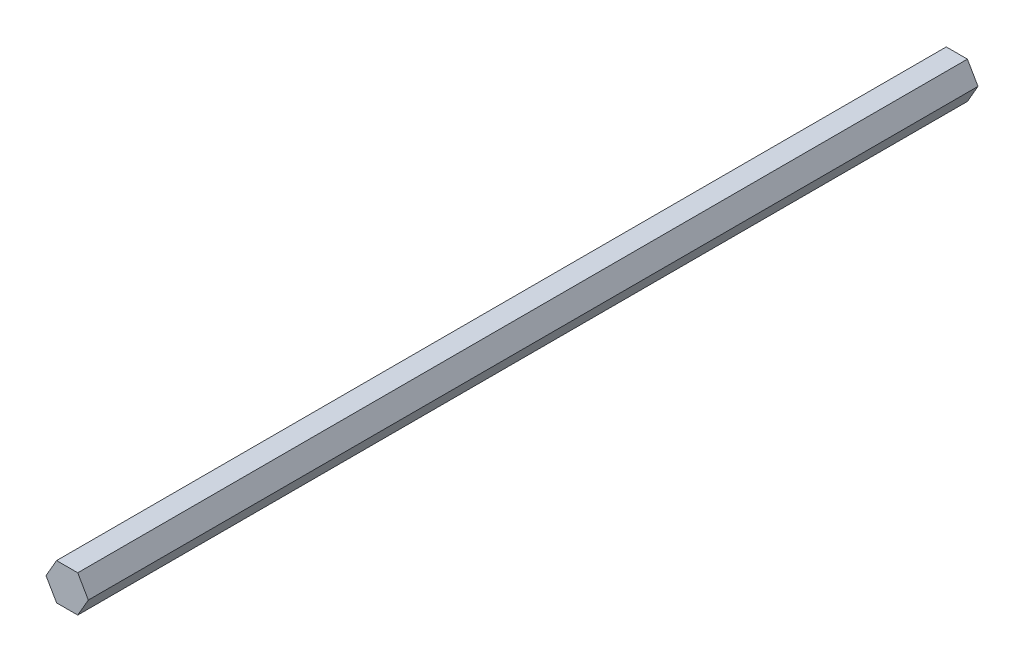
from build123d import *

# Parameters (mm, degrees)
AXIS_DEPTH = 42


with BuildPart() as part:
    # AxisSke → Axis (new body)
    with BuildSketch(Plane.XY):
        Polygon((0.998815966, 0), (0.499407983, 0.865), (-0.499407983, 0.865), (-0.998815966, 0), (-0.499407983, -0.865), (0.499407983, -0.865), align=None)
    extrude(amount=AXIS_DEPTH)


solid = part.part
